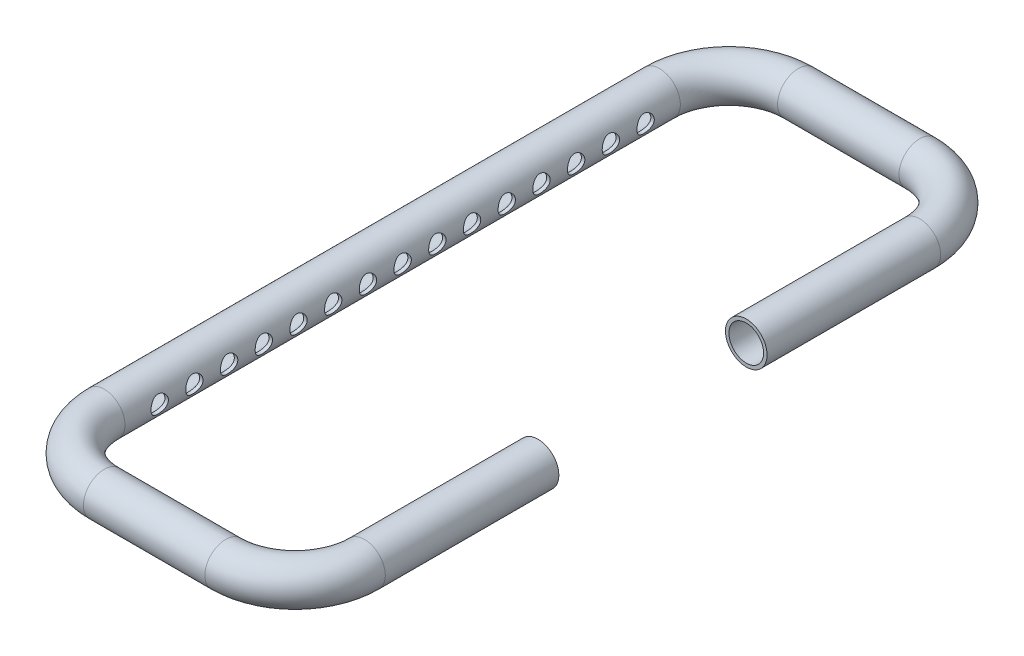
from build123d import *

# Parameters (mm, degrees)
SKETCH4_R          = 6
SKETCH4_R_2        = 5
SKETCH7_R          = 2.5
CUT_EXTRUDE1_DEPTH = 25


with BuildPart() as part:
    # Sweep1: sweep along a path in Sketch5
    with BuildLine(Plane(origin=(0, 0, 0), x_dir=(-1, 0, 0), z_dir=(0, 1, 0))) as sweep1_path:
        Line((0, 0), (0, -50))
        ThreePointArc((0, -50), (5.857864376, -64.142135624), (20, -70))
        Line((20, -70), (55, -70))
        ThreePointArc((55, -70), (69.142135624, -64.142135624), (75, -50))
        Line((75, -50), (75, 110))
        ThreePointArc((75, 110), (69.142135624, 124.142135624), (55, 130))
        Line((55, 130), (20, 130))
        ThreePointArc((20, 130), (5.857864376, 124.142135624), (0, 110))
        Line((0, 110), (0, 60))
    # Sketch4 → Sweep1 (sweep)
    with BuildSketch(Plane(origin=(0, 0, 0), x_dir=(0, 1, 0), z_dir=(0, 0, 1))):
        Circle(SKETCH4_R)
        Circle(SKETCH4_R_2, mode=Mode.SUBTRACT)
    sweep(path=sweep1_path.line)

    # Sketch7 → Cut-Extrude1 (cut)
    with BuildSketch(Plane(origin=(-86, 0, 0), x_dir=(0, 0, -1), z_dir=(1, 0, 0))):
        with Locations(Location((-100, 0, 0), (0, 0, 180))):
            Circle(SKETCH7_R)
        with Locations(Location((-90, 0, 0), (0, 0, 180))):
            Circle(SKETCH7_R)
        with Locations(Location((-80, 0, 0), (0, 0, 180))):
            Circle(SKETCH7_R)
        with Locations(Location((-70, 0, 0), (0, 0, 180))):
            Circle(SKETCH7_R)
        with Locations(Location((-60, 0, 0), (0, 0, 180))):
            Circle(SKETCH7_R)
        with Locations(Location((-50, 0, 0), (0, 0, 180))):
            Circle(SKETCH7_R)
        with Locations(Location((-40, 0, 0), (0, 0, 180))):
            Circle(SKETCH7_R)
        with Locations(Location((-30, 0, 0), (0, 0, 180))):
            Circle(SKETCH7_R)
        with Locations(Location((-20, 0, 0), (0, 0, 180))):
            Circle(SKETCH7_R)
        with Locations(Location((-10, 0, 0), (0, 0, 180))):
            Circle(SKETCH7_R)
        with Locations(Location((0, 0, 0), (0, 0, 180))):
            Circle(SKETCH7_R)
        with Locations(Location((10, 0, 0), (0, 0, 180))):
            Circle(SKETCH7_R)
        with Locations(Location((20, 0, 0), (0, 0, 180))):
            Circle(SKETCH7_R)
        with Locations(Location((30, 0, 0), (0, 0, 180))):
            Circle(SKETCH7_R)
        with Locations(Location((40, 0, 0), (0, 0, 180))):
            Circle(SKETCH7_R)
    extrude(amount=CUT_EXTRUDE1_DEPTH, mode=Mode.SUBTRACT)


solid = part.part
